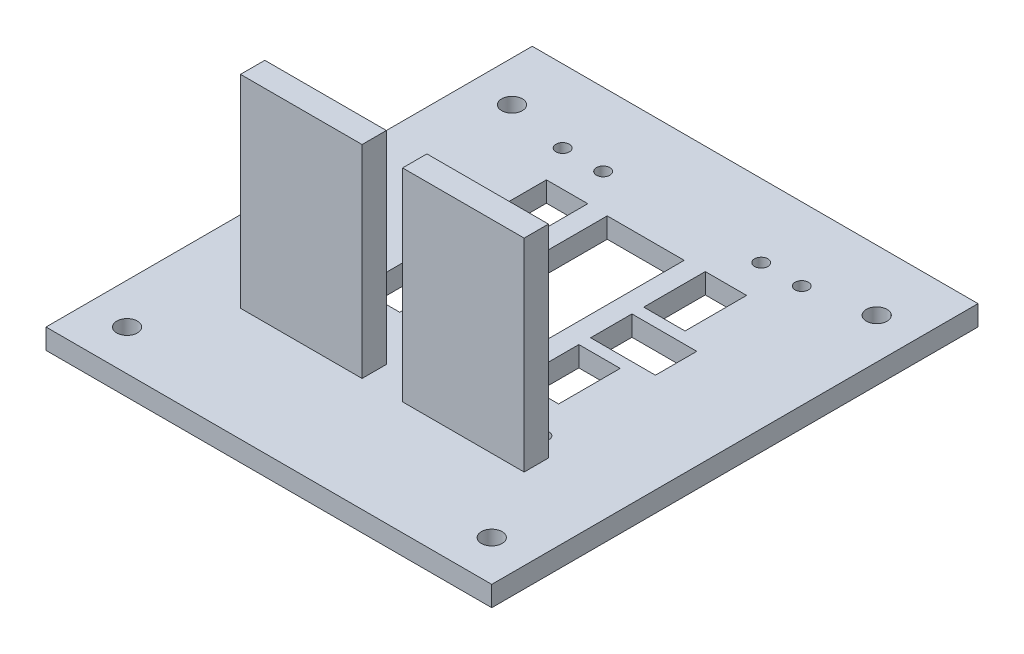
from build123d import *

# Parameters (mm, degrees)
SKETCH1_R           = 1.65
SKETCH1_W           = 19
SKETCH1_H           = 46
BOSS_EXTRUDE3_DEPTH = 5
SKETCH5_R           = 2.55
CUT_EXTRUDE2_DEPTH  = 90.162772501
SKETCH9_W           = 10.2
SKETCH9_H           = 15.2
CUT_EXTRUDE3_DEPTH  = 90.162772501
SKETCH6_W           = 30
SKETCH6_H           = 6
BOSS_EXTRUDE4_DEPTH = 50
SKETCH11_W          = 16
SKETCH11_H          = 10.2
CUT_EXTRUDE4_DEPTH  = 103.102889283


with BuildPart() as part:
    # Sketch1 → Boss-Extrude3 (new body)
    with BuildSketch(Plane(origin=(0, 0, 0), x_dir=(1, 0, 0), z_dir=(0, 1, 0))):
        Polygon((55, 50), (-55, 50), (-55, 31.75), (-55, -31.75), (-55, -70), (-20, -70), (2.5, -70), (20, -70), (42.5, -70), (55, -70), (55, -31.75), (55, 31.75), align=None)
        with Locations(Location((-29.5, -32, 0), (0, 0, 270))):
            Circle(SKETCH1_R, mode=Mode.SUBTRACT)
        with Locations(Location((-19.5, -32, 0), (0, 0, 270))):
            Circle(SKETCH1_R, mode=Mode.SUBTRACT)
        with Locations(Location((19.5, -32, 0), (0, 0, 270))):
            Circle(SKETCH1_R, mode=Mode.SUBTRACT)
        with Locations(Location((29.5, -32, 0), (0, 0, 270))):
            Circle(SKETCH1_R, mode=Mode.SUBTRACT)
        with Locations(Location((-29.5, 32, 0), (0, 0, 270))):
            Circle(SKETCH1_R, mode=Mode.SUBTRACT)
        with Locations(Location((-19.5, 32, 0), (0, 0, 270))):
            Circle(SKETCH1_R, mode=Mode.SUBTRACT)
        Rectangle(SKETCH1_W, SKETCH1_H, mode=Mode.SUBTRACT)
        with Locations(Location((19.5, 32, 0), (0, 0, 270))):
            Circle(SKETCH1_R, mode=Mode.SUBTRACT)
        with Locations(Location((29.5, 32, 0), (0, 0, 270))):
            Circle(SKETCH1_R, mode=Mode.SUBTRACT)
    extrude(amount=BOSS_EXTRUDE3_DEPTH)

    # Sketch5 → Cut-Extrude2 (cut, through all)
    with BuildSketch(Plane.XZ):
        with Locations(Location((-45, 60, 0), (0, 0, 270))):
            Circle(SKETCH5_R)
        with Locations(Location((-45, -35, 0), (0, 0, 270))):
            Circle(SKETCH5_R)
        with Locations(Location((45, -35, 0), (0, 0, 90))):
            Circle(SKETCH5_R)
        with Locations(Location((45, 60, 0), (0, 0, 90))):
            Circle(SKETCH5_R)
    extrude(amount=-CUT_EXTRUDE2_DEPTH, mode=Mode.SUBTRACT)

    # Sketch9 → Cut-Extrude3 (cut, through all)
    with BuildSketch(Plane(origin=(0, 5, 0), x_dir=(1, 0, 0), z_dir=(0, 1, 0))):
        with Locations((-19.6, 15.6)):
            Rectangle(SKETCH9_W, SKETCH9_H)
        with Locations((-19.6, -15.6)):
            Rectangle(SKETCH9_W, SKETCH9_H)
        with Locations((19.6, -15.6)):
            Rectangle(SKETCH9_W, SKETCH9_H)
        with Locations((19.6, 15.6)):
            Rectangle(SKETCH9_W, SKETCH9_H)
    extrude(amount=-CUT_EXTRUDE3_DEPTH, mode=Mode.SUBTRACT)

    # Sketch6 → Boss-Extrude4 (add)
    with BuildSketch(Plane(origin=(0, 5, 0), x_dir=(1, 0, 0), z_dir=(0, 1, 0))):
        with Locations((-20, -39)):
            Rectangle(SKETCH6_W, SKETCH6_H)
        with Locations((20, -39)):
            Rectangle(SKETCH6_W, SKETCH6_H)
    extrude(amount=BOSS_EXTRUDE4_DEPTH)

    # Sketch11 → Cut-Extrude4 (cut, through all)
    with BuildSketch(Plane(origin=(0, 5, 0), x_dir=(1, 0, 0), z_dir=(0, 1, 0))):
        with Locations((22.5, 0)):
            Rectangle(SKETCH11_W, SKETCH11_H)
    extrude(amount=-CUT_EXTRUDE4_DEPTH, mode=Mode.SUBTRACT)


solid = part.part
